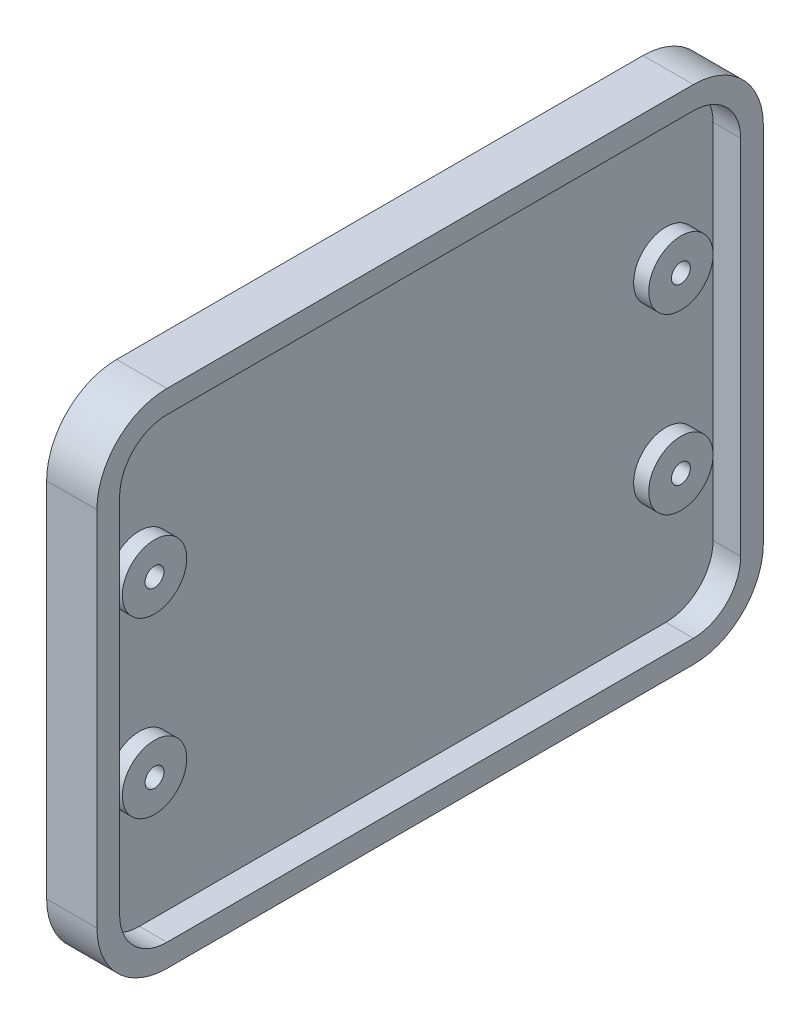
from build123d import *

# Parameters (mm, degrees)
BOSS_EXTRUDE1_DEPTH = 3
SKETCH1_3_R         = 4.25
SKETCH1_3_R_2       = 1.25
BOSS_EXTRUDE2_DEPTH = 2
BOSS_EXTRUDE3_START = 3.64
BOSS_EXTRUDE3_DEPTH = 3.64
CUT_EXTRUDE1_REACH  = 107.747
SKETCH1_5_R         = 1.25


with BuildPart() as part:
    # Sketch1 → Boss-Extrude1 (new body)
    with BuildSketch(Plane(origin=(0, 0, 0), x_dir=(0, 0, -1), z_dir=(1, 0, 0))):
        with BuildLine():
            Line((-6, 3.25), (-75.53, 3.25))
            ThreePointArc((-75.53, 3.25), (-82.070737726, 0.540737726), (-84.78, -6))
            Line((-84.78, -6), (-84.78, -53.85))
            ThreePointArc((-84.78, -53.85), (-82.070737726, -60.390737726), (-75.53, -63.1))
            Line((-75.53, -63.1), (-6, -63.1))
            ThreePointArc((-6, -63.1), (0.540737726, -60.390737726), (3.25, -53.85))
            Line((3.25, -53.85), (3.25, -6))
            ThreePointArc((3.25, -6), (0.540737726, 0.540737726), (-6, 3.25))
        make_face()
    extrude(amount=-BOSS_EXTRUDE1_DEPTH)

    # Sketch1<3> → Boss-Extrude2 (add)
    # profile 1 of 4: a face of its own
    with BuildSketch(Plane(origin=(0, 0, 0), x_dir=(0, 0, -1), z_dir=(1, 0, 0))):
        with Locations((-75.53, -19.12)):
            Circle(SKETCH1_3_R)
        with Locations((-75.53, -19.12)):
            Circle(SKETCH1_3_R_2, mode=Mode.SUBTRACT)
    # profile 2 of 4: a face of its own
    with BuildSketch(Plane(origin=(0, 0, 0), x_dir=(0, 0, -1), z_dir=(1, 0, 0))):
        with Locations((-6, -19.12)):
            Circle(SKETCH1_3_R)
        with Locations((-6, -19.12)):
            Circle(SKETCH1_3_R_2, mode=Mode.SUBTRACT)
    # profile 3 of 4: a face of its own
    with BuildSketch(Plane(origin=(0, 0, 0), x_dir=(0, 0, -1), z_dir=(1, 0, 0))):
        with Locations((-6, -42.05)):
            Circle(SKETCH1_3_R)
        with Locations((-6, -42.05)):
            Circle(SKETCH1_3_R_2, mode=Mode.SUBTRACT)
    # profile 4 of 4: a face of its own
    with BuildSketch(Plane(origin=(0, 0, 0), x_dir=(0, 0, -1), z_dir=(1, 0, 0))):
        with Locations((-75.53, -42.05)):
            Circle(SKETCH1_3_R)
        with Locations((-75.53, -42.05)):
            Circle(SKETCH1_3_R_2, mode=Mode.SUBTRACT)
    extrude(amount=BOSS_EXTRUDE2_DEPTH)

    # Sketch1<4> → Boss-Extrude3 (add)
    with BuildSketch(Plane(origin=(0, 0, 0), x_dir=(0, 0, -1), z_dir=(1, 0, 0)).offset(BOSS_EXTRUDE3_START)):
        with BuildLine():
            ThreePointArc((3.25, -6), (0.540737726, 0.540737726), (-6, 3.25))
            Line((-6, 3.25), (-75.53, 3.25))
            ThreePointArc((-75.53, 3.25), (-82.070737726, 0.540737726), (-84.78, -6))
            Line((-84.78, -6), (-84.78, -53.85))
            ThreePointArc((-84.78, -53.85), (-82.070737726, -60.390737726), (-75.53, -63.1))
            Line((-75.53, -63.1), (-6, -63.1))
            ThreePointArc((-6, -63.1), (0.540737726, -60.390737726), (3.25, -53.85))
            Line((3.25, -53.85), (3.25, -6))
        make_face()
        with BuildLine():
            Line((-75.53, 0.25), (-6, 0.25))
            ThreePointArc((-6, 0.25), (-1.580582618, -1.580582618), (0.25, -6))
            Line((0.25, -6), (0.25, -53.85))
            ThreePointArc((0.25, -53.85), (-1.580582618, -58.269417382), (-6, -60.1))
            Line((-6, -60.1), (-75.53, -60.1))
            ThreePointArc((-75.53, -60.1), (-79.949417382, -58.269417382), (-81.78, -53.85))
            Line((-81.78, -53.85), (-81.78, -6))
            ThreePointArc((-81.78, -6), (-79.949417382, -1.580582618), (-75.53, 0.25))
        make_face(mode=Mode.SUBTRACT)
    extrude(amount=-BOSS_EXTRUDE3_DEPTH)

    # Sketch1<5> → Cut-Extrude1 (cut, up to next)
    with BuildSketch(Plane(origin=(0, 0, 0), x_dir=(0, 0, -1), z_dir=(1, 0, 0)), mode=Mode.PRIVATE) as cut_extrude1_sk1:
        with Locations((-6, -19.12)):
            Circle(SKETCH1_5_R)
    cut_extrude1_tool1 = extrude(cut_extrude1_sk1.sketch, amount=-CUT_EXTRUDE1_REACH, mode=Mode.PRIVATE) & part.part
    # Sketch1<5> → Cut-Extrude1 (cut, up to next)
    with BuildSketch(Plane(origin=(0, 0, 0), x_dir=(0, 0, -1), z_dir=(1, 0, 0)), mode=Mode.PRIVATE) as cut_extrude1_sk2:
        with Locations((-6, -42.05)):
            Circle(SKETCH1_5_R)
    cut_extrude1_tool2 = extrude(cut_extrude1_sk2.sketch, amount=-CUT_EXTRUDE1_REACH, mode=Mode.PRIVATE) & part.part
    # Sketch1<5> → Cut-Extrude1 (cut, up to next)
    with BuildSketch(Plane(origin=(0, 0, 0), x_dir=(0, 0, -1), z_dir=(1, 0, 0)), mode=Mode.PRIVATE) as cut_extrude1_sk3:
        with Locations((-75.53, -19.12)):
            Circle(SKETCH1_5_R)
    cut_extrude1_tool3 = extrude(cut_extrude1_sk3.sketch, amount=-CUT_EXTRUDE1_REACH, mode=Mode.PRIVATE) & part.part
    # Sketch1<5> → Cut-Extrude1 (cut, up to next)
    with BuildSketch(Plane(origin=(0, 0, 0), x_dir=(0, 0, -1), z_dir=(1, 0, 0)), mode=Mode.PRIVATE) as cut_extrude1_sk4:
        with Locations((-75.53, -42.05)):
            Circle(SKETCH1_5_R)
    cut_extrude1_tool4 = extrude(cut_extrude1_sk4.sketch, amount=-CUT_EXTRUDE1_REACH, mode=Mode.PRIVATE) & part.part
    add(cut_extrude1_tool1.solids().sort_by_distance((0, -19.12, 6))[0], mode=Mode.SUBTRACT)
    add(cut_extrude1_tool2.solids().sort_by_distance((0, -42.05, 6))[0], mode=Mode.SUBTRACT)
    add(cut_extrude1_tool3.solids().sort_by_distance((0, -19.12, 75.53))[0], mode=Mode.SUBTRACT)
    add(cut_extrude1_tool4.solids().sort_by_distance((0, -42.05, 75.53))[0], mode=Mode.SUBTRACT)


solid = part.part
